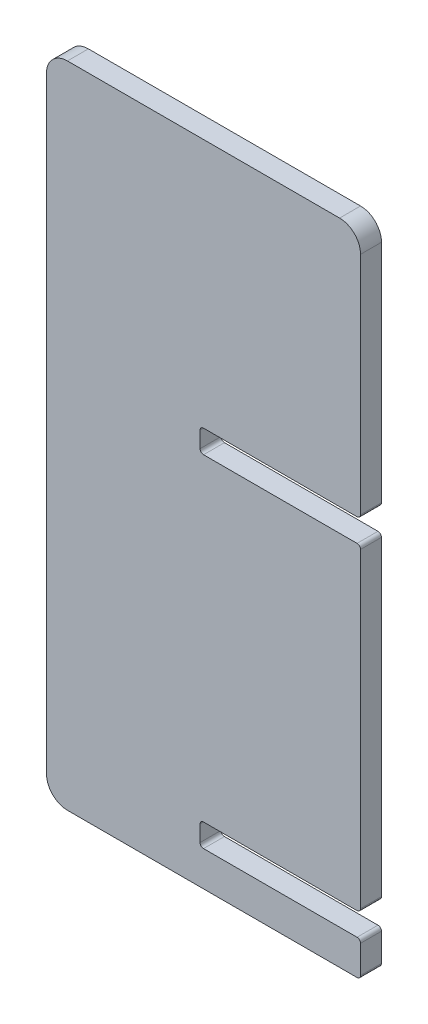
from build123d import *

# Parameters (mm, degrees)
CROQUIS1_W              = 45
CROQUIS1_H              = 93
SALIENTE_EXTRUIR1_DEPTH = 3
CROQUIS2_W              = 23
CROQUIS2_H              = 3.3
CORTAR_EXTRUIR1_DEPTH   = 3
CROQUIS3_W              = 23
CROQUIS3_H              = 3.3
CORTAR_EXTRUIR2_DEPTH   = 3
REDONDEO1_R             = 3
REDONDEO2_R             = 0.5


with BuildPart() as part:
    # Croquis1 → Saliente-Extruir1 (new body)
    with BuildSketch(Plane.XY):
        with Locations((0, -1.5)):
            Rectangle(CROQUIS1_W, CROQUIS1_H)
    extrude(amount=SALIENTE_EXTRUIR1_DEPTH)

    # Croquis2 → Cortar-Extruir1 (cut)
    with BuildSketch(Plane.XY.offset(3)):
        with Locations((11, 7.529451896)):
            Rectangle(CROQUIS2_W, CROQUIS2_H)
    extrude(amount=-CORTAR_EXTRUIR1_DEPTH, mode=Mode.SUBTRACT)

    # Croquis3 → Cortar-Extruir2 (cut)
    with BuildSketch(Plane.XY.offset(3)):
        with Locations((11, -41.35)):
            Rectangle(CROQUIS3_W, CROQUIS3_H)
    extrude(amount=-CORTAR_EXTRUIR2_DEPTH, mode=Mode.SUBTRACT)

    # Redondeo1
    redondeo1_edges = [part.edges().sort_by_distance(p)[0] for p in [
        (-22.5, 45, 1.5),
        (-22.5, -48, 1.5),
        (22.5, 45, 1.5),
    ]]
    fillet(redondeo1_edges, radius=REDONDEO1_R)

    # Redondeo2
    redondeo2_edges = [part.edges().sort_by_distance(p)[0] for p in [
        (-0.5, 9.179451896, 1.5),
        (-0.5, 5.879451896, 1.5),
        (22.5, 5.879451896, 1.5),
        (22.5, 9.179451896, 1.5),
        (-0.5, -39.7, 1.5),
        (-0.5, -43, 1.5),
        (22.5, -43, 1.5),
        (22.5, -39.7, 1.5),
        (22.5, -48, 1.5),
    ]]
    fillet(redondeo2_edges, radius=REDONDEO2_R)


solid = part.part
